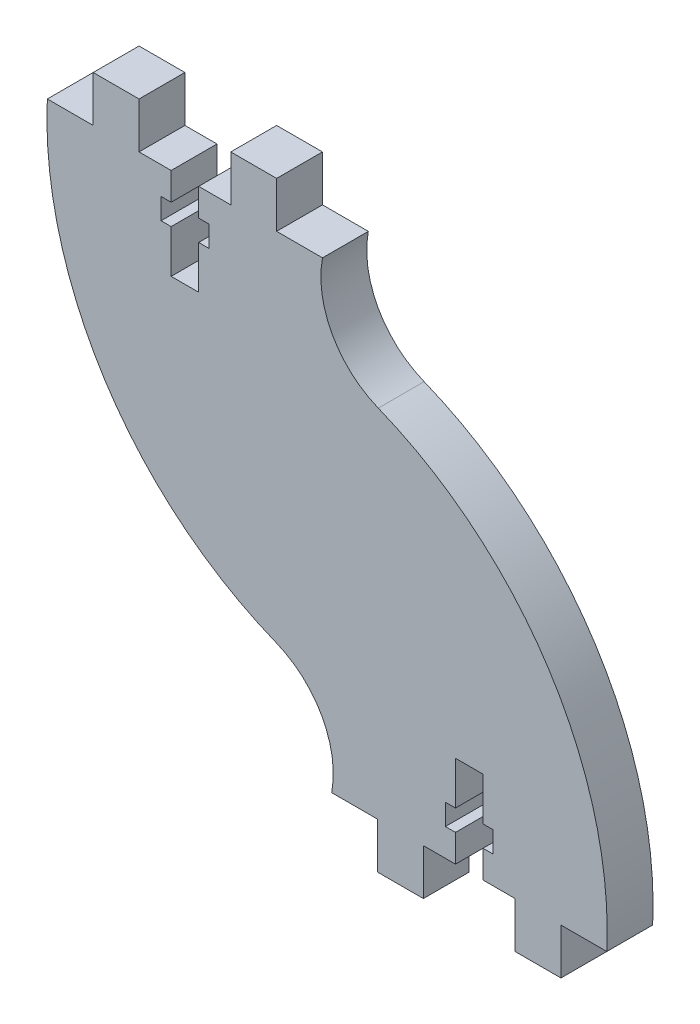
from build123d import *

# Parameters (mm, degrees)
BOSS_EXTRUDE1_DEPTH = 5


with BuildPart() as part:
    # Sketch1 → Boss-Extrude1 (new body)
    with BuildSketch(Plane.XY):
        with BuildLine():
            Line((-11, 50), (-6, 50))
            ThreePointArc((-6, 50), (-4.955689192, 43.335228836), (0.083613647, 38.850233113))
            ThreePointArc((0.083613647, 38.850233113), (18.735492032, 23.397402982), (25, 0))
            Line((25, 0), (20, 0))
            Line((20, 0), (20, -5))
            Line((20, -5), (15, -5))
            Line((15, -5), (15, 0))
            Line((15, 0), (11.5, 0))
            Line((11.5, 0), (11.5, 3))
            Line((11.5, 3), (12.6, 3))
            Line((12.6, 3), (12.6, 5.3))
            Line((12.6, 5.3), (11.5, 5.3))
            Line((11.5, 5.3), (11.5, 10))
            Line((11.5, 10), (8.5, 10))
            Line((8.5, 10), (8.5, 5.3))
            Line((8.5, 5.3), (7.4, 5.3))
            Line((7.4, 5.3), (7.4, 3))
            Line((7.4, 3), (8.5, 3))
            Line((8.5, 3), (8.5, 0))
            Line((8.5, 0), (5, 0))
            Line((5, 0), (5, -5))
            Line((5, -5), (0, -5))
            Line((0, -5), (0, 0))
            Line((0, 0), (-5, 0))
            ThreePointArc((-5, 0), (-6.044310808, 6.664771164), (-11.083613647, 11.149766887))
            ThreePointArc((-11.083613647, 11.149766887), (-29.735492032, 26.602597018), (-36, 50))
            Line((-36, 50), (-31, 50))
            Line((-31, 50), (-31, 55))
            Line((-31, 55), (-26, 55))
            Line((-26, 55), (-26, 50))
            Line((-26, 50), (-22.5, 50))
            Line((-22.5, 50), (-22.5, 47))
            Line((-22.5, 47), (-23.6, 47))
            Line((-23.6, 47), (-23.6, 44.7))
            Line((-23.6, 44.7), (-22.5, 44.7))
            Line((-22.5, 44.7), (-22.5, 40))
            Line((-22.5, 40), (-19.5, 40))
            Line((-19.5, 40), (-19.5, 44.7))
            Line((-19.5, 44.7), (-18.4, 44.7))
            Line((-18.4, 44.7), (-18.4, 47))
            Line((-18.4, 47), (-19.5, 47))
            Line((-19.5, 47), (-19.5, 50))
            Line((-19.5, 50), (-16, 50))
            Line((-16, 50), (-16, 55))
            Line((-16, 55), (-11, 55))
            Line((-11, 55), (-11, 50))
        make_face()
    extrude(amount=BOSS_EXTRUDE1_DEPTH)


solid = part.part
